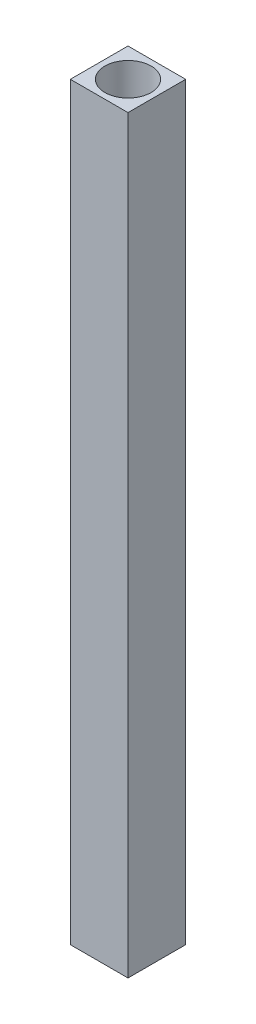
from build123d import *

# Parameters (mm, degrees)
SKETCH_1_W          = 10
SKETCH_1_H          = 10
EXTRUDE_1_DEPTH     = 130
SKETCH_2_R          = 4
CUT_EXTRUDE_1_DEPTH = 130


with BuildPart() as part:
    # 草图1 → 凸台-拉伸1 (new body)
    with BuildSketch(Plane(origin=(0, 0, 0), x_dir=(1, 0, 0), z_dir=(0, 1, 0))):
        Rectangle(SKETCH_1_W, SKETCH_1_H)
    extrude(amount=EXTRUDE_1_DEPTH)

    # 草图2 → 切除-拉伸1 (cut)
    with BuildSketch(Plane(origin=(5, 130, 5), x_dir=(1, 0, 0), z_dir=(0, -1, 0))):
        with Locations(Location((-5, -5, 0), (0, 0, 270))):
            Circle(SKETCH_2_R)
    extrude(amount=CUT_EXTRUDE_1_DEPTH, mode=Mode.SUBTRACT)


solid = part.part
